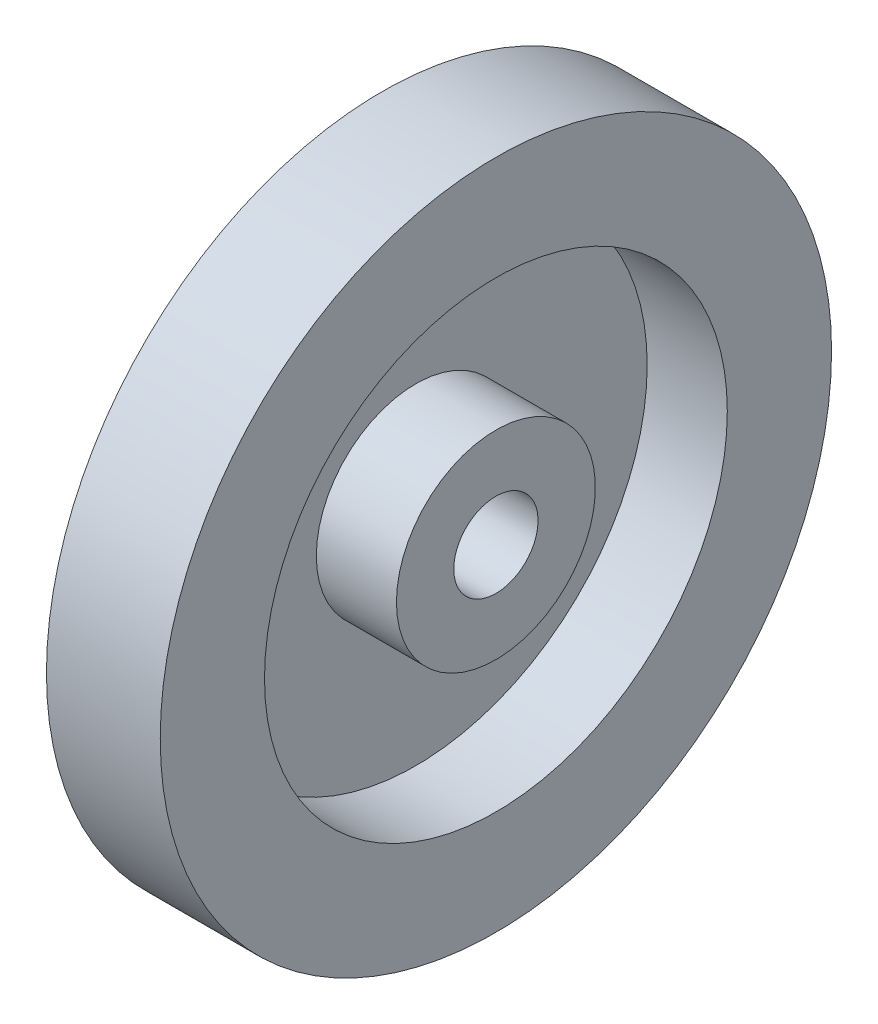
from build123d import *


with BuildPart() as part:
    # Sketch1 → Revolve1 (revolve)
    with BuildSketch(Plane.XY, mode=Mode.PRIVATE) as revolve1_sk:
        Polygon((0, 159.326308126), (54.016357681, 159.326308126), (54.016357681, 109.840732834), (15.987304294, 109.840732834), (15.987304294, 47.21395863), (54.016357681, 47.21395863), (54.016357681, 20), (0, 20), align=None)
    revolve(revolve1_sk.sketch.rotate(Axis((0, 0, 0), (1, 0, 0)), 90), axis=Axis((0, 0, 0), (1, 0, 0)))


solid = part.part
